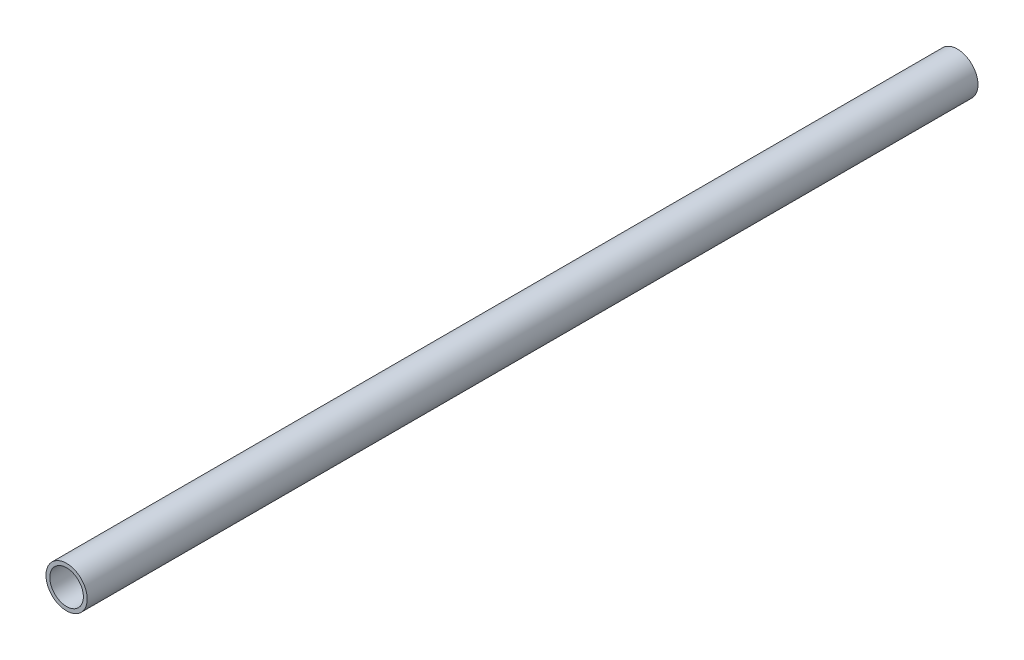
from build123d import *

# Parameters (mm, degrees)
CROQUIS1_R              = 8.1
CROQUIS1_R_2            = 6.6
SALIENTE_EXTRUIR1_DEPTH = 175


with BuildPart() as part:
    # Croquis1 → Saliente-Extruir1 (new, symmetric)
    with BuildSketch(Plane.XY):
        Circle(CROQUIS1_R)
        Circle(CROQUIS1_R_2, mode=Mode.SUBTRACT)
    extrude(amount=SALIENTE_EXTRUIR1_DEPTH, both=True)


solid = part.part
